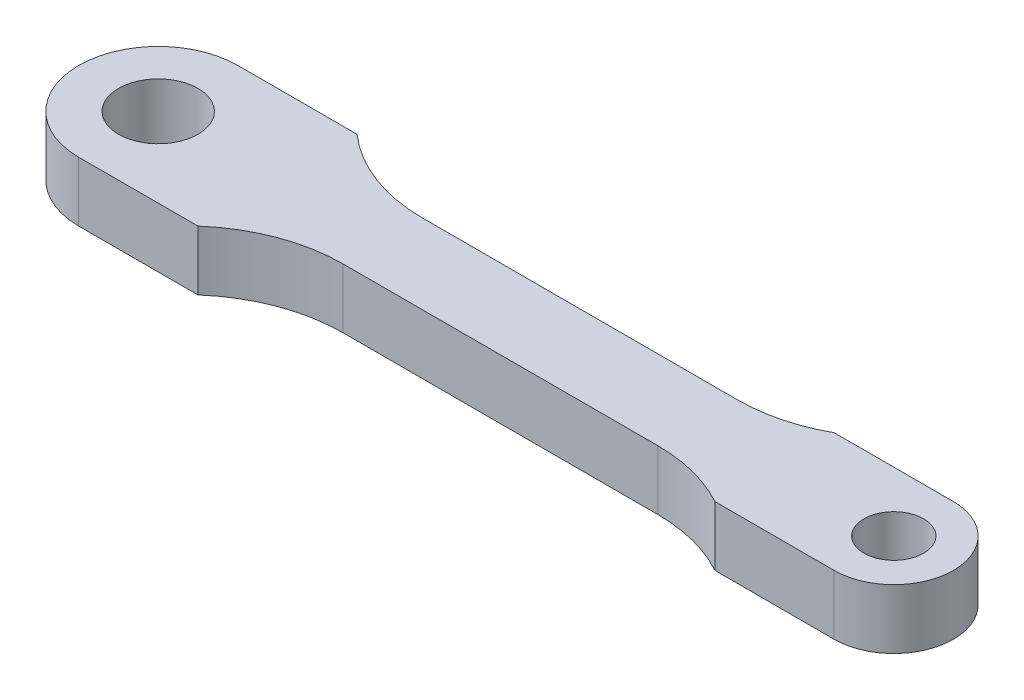
from build123d import *

# Parameters (mm, degrees)
SKETCH1_R           = 2
SKETCH1_R_2         = 1.5
BOSS_EXTRUDE1_DEPTH = 1.5
SCALE1_SCALE        = 1.5


with BuildPart() as part:
    # Sketch1 → Boss-Extrude1 (new, symmetric)
    with BuildSketch(Plane(origin=(0, 0, 0), x_dir=(1, 0, 0), z_dir=(0, 1, 0))):
        with BuildLine():
            ThreePointArc((-18.5, 4), (-22.5, 0), (-18.5, -4))
            Line((-18.5, -4), (-12.5, -4))
            ThreePointArc((-12.5, -4), (-10.036924503, -2.516685226), (-7.208497378, -2))
            Line((-7.208497378, -2), (8.627016654, -2))
            ThreePointArc((8.627016654, -2), (10.627016654, -2.254033308), (12.5, -3))
            Line((12.5, -3), (18.5, -3))
            ThreePointArc((18.5, -3), (21.5, 0), (18.5, 3))
            Line((18.5, 3), (12.5, 3))
            ThreePointArc((12.5, 3), (10.627016654, 2.254033308), (8.627016654, 2))
            Line((8.627016654, 2), (-7.208497378, 2))
            ThreePointArc((-7.208497378, 2), (-10.036924503, 2.516685226), (-12.5, 4))
            Line((-12.5, 4), (-18.5, 4))
        make_face()
        with Locations(Location((-18.5, 0, 0), (0, 0, 270))):
            Circle(SKETCH1_R, mode=Mode.SUBTRACT)
        with Locations(Location((18.5, 0, 0), (0, 0, 270))):
            Circle(SKETCH1_R_2, mode=Mode.SUBTRACT)
    extrude(amount=BOSS_EXTRUDE1_DEPTH, both=True)


with BuildPart() as part_1:
    # Scale1: scaled about (-1.682409561, 0, 0)
    add(part.part.scale(SCALE1_SCALE).moved(Location((0.841204781, 0, 0))))


solid = part_1.part
